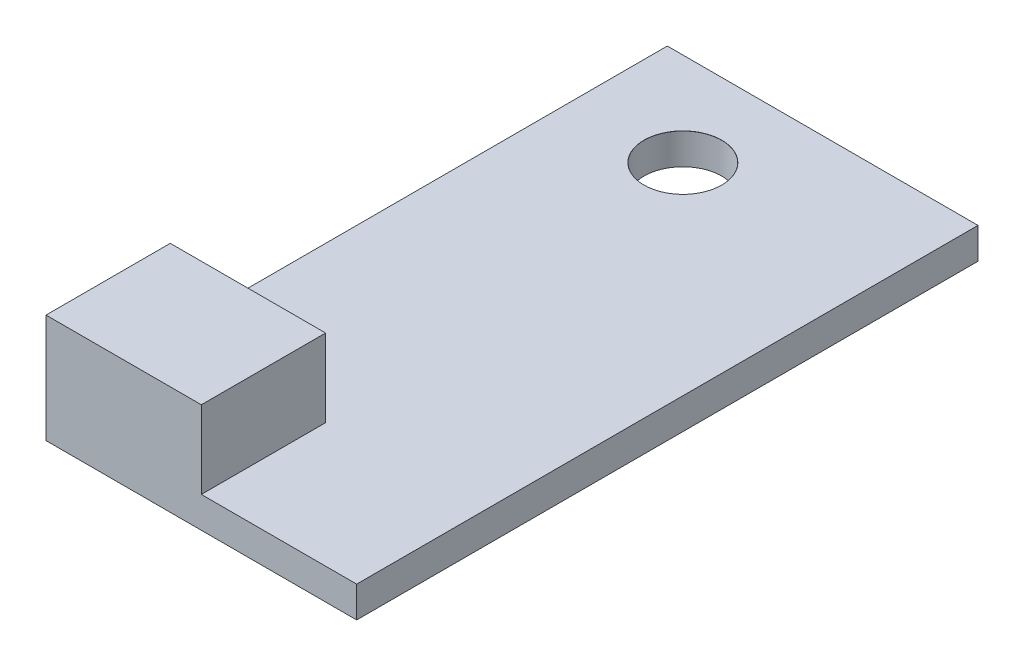
from build123d import *

# Parameters (mm, degrees)
SKETCH1_W           = 100
SKETCH1_H           = 200
BOSS_EXTRUDE1_DEPTH = 10
SKETCH3_W           = 50
SKETCH3_H           = 40
BOSS_EXTRUDE2_DEPTH = 25


with BuildPart() as part:
    # Sketch1 → Boss-Extrude1 (new body)
    with BuildSketch(Plane(origin=(0, 0, 0), x_dir=(1, 0, 0), z_dir=(0, 1, 0))):
        with Locations((50, 100)):
            Rectangle(SKETCH1_W, SKETCH1_H)
    extrude(amount=BOSS_EXTRUDE1_DEPTH)

    # Sketch3 → Boss-Extrude2 (add)
    with BuildSketch(Plane(origin=(0, 10, 0), x_dir=(1, 0, 0), z_dir=(0, 1, 0))):
        with Locations((25, 20)):
            Rectangle(SKETCH3_W, SKETCH3_H)
    extrude(amount=BOSS_EXTRUDE2_DEPTH)

    # Sketch9 → Ø25.0 (25) Diameter Hole2 (revolve, cut)
    with BuildSketch(Plane(origin=(35, 10, -170), x_dir=(0, 0, 1), z_dir=(1, 0, 0))):
        Polygon((0, 0), (0, 10), (12.5, 10), (12.5, 0.025), (12.525, 0), align=None)
    revolve(axis=Axis((35, 16.35, -170), (0, -1, 0)), mode=Mode.SUBTRACT)


solid = part.part
